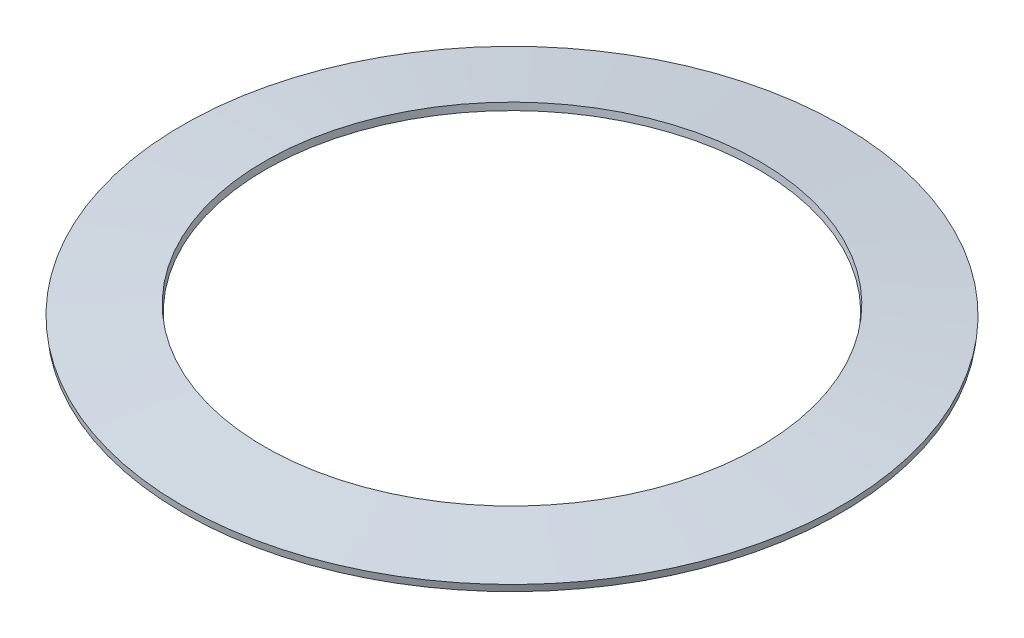
from build123d import *


with BuildPart() as part:
    # Sketch1 → Revolve1 (revolve)
    with BuildSketch(Plane.XY, mode=Mode.PRIVATE) as revolve1_sk:
        Polygon((33.667013956, 0), (25.25, 1.004936466), (25.332986044, 1.7), (33.75, 0.695063534), align=None)
    revolve(revolve1_sk.sketch.rotate(Axis((0, 0, 0), (0, 1, 0)), 90), axis=Axis((0, 0, 0), (0, 1, 0)))


solid = part.part
